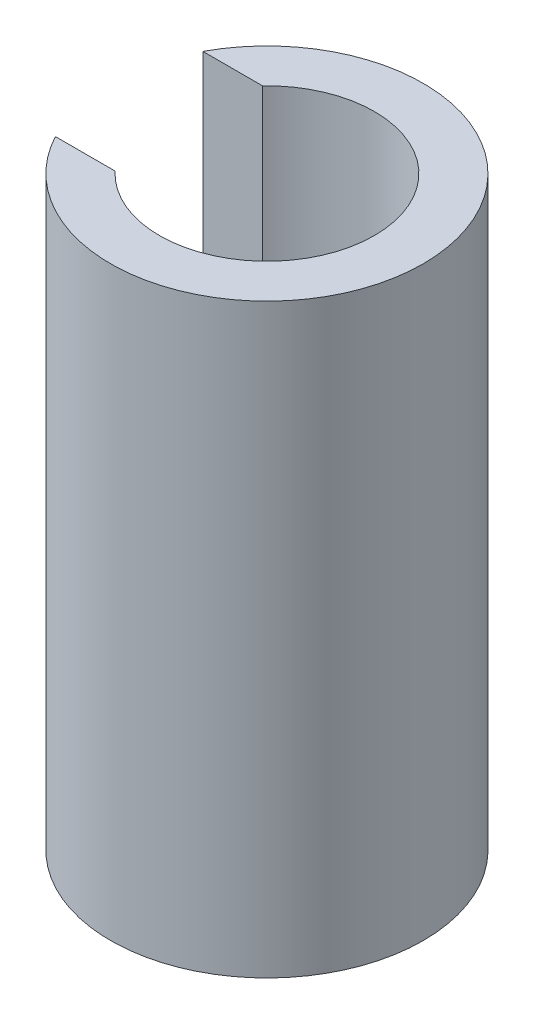
from build123d import *

# Parameters (mm, degrees)
SKETCH_1_R          = 4
SKETCH_1_R_2        = 2.75
EXTRUDE_1_DEPTH     = 15
SKETCH_2_W          = 2
SKETCH_2_H          = 3.774917218
CUT_EXTRUDE_1_DEPTH = 15


with BuildPart() as part:
    # 草圖1 → 填料-伸長1 (new body)
    with BuildSketch(Plane(origin=(0, 0, 0), x_dir=(1, 0, 0), z_dir=(0, 1, 0))):
        Circle(SKETCH_1_R)
        Circle(SKETCH_1_R_2, mode=Mode.SUBTRACT)
    extrude(amount=EXTRUDE_1_DEPTH)

    # 草圖2 → 除料-伸長1 (cut)
    with BuildSketch(Plane(origin=(0, 15, 0), x_dir=(1, 0, 0), z_dir=(0, 1, 0))):
        with Locations((-3, 0)):
            Rectangle(SKETCH_2_W, SKETCH_2_H)
    extrude(amount=-CUT_EXTRUDE_1_DEPTH, mode=Mode.SUBTRACT)


solid = part.part
